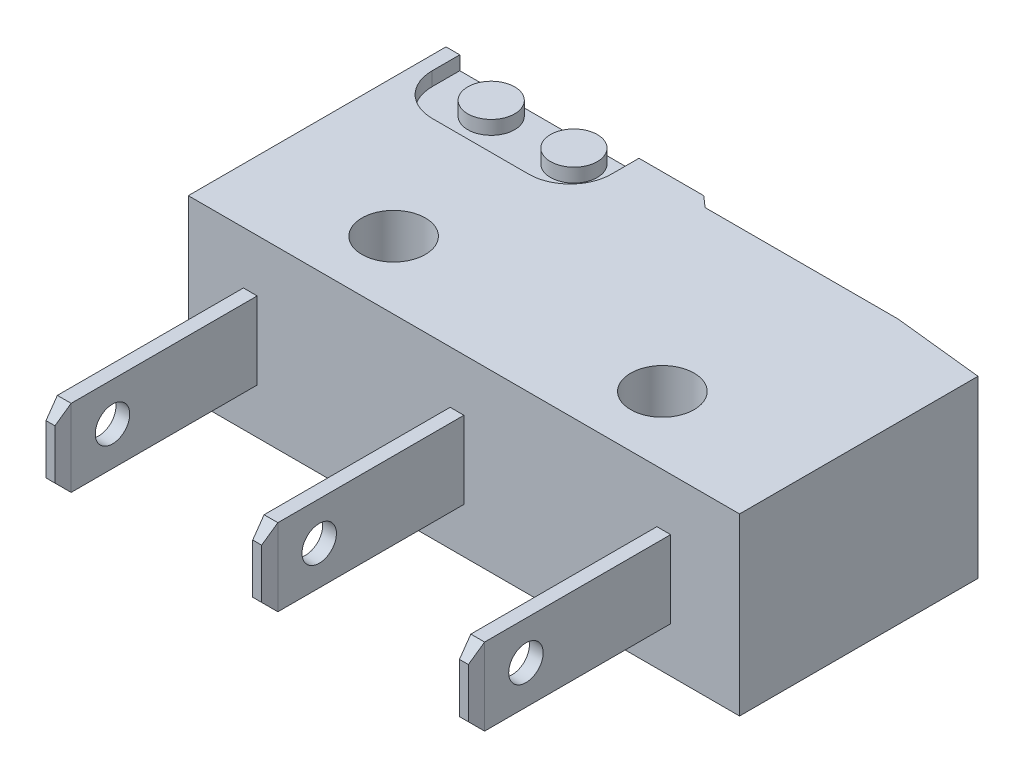
from build123d import *
from OCP.BRepFilletAPI import BRepFilletAPI_MakeChamfer

# Parameters (mm, degrees)
BOSS_EXTRUDE1_DEPTH = 6.35
SKETCH2_R           = 1.15
CUT_EXTRUDE1_DEPTH  = 6.35
SKETCH3_W           = 0.5
SKETCH3_H           = 2.8
BOSS_EXTRUDE2_DEPTH = 7.25
SKETCH4_R           = 0.625
CUT_EXTRUDE2_DEPTH  = 16.25
CHAMFER1_SIZE       = 0.5
CHAMFER2_SIZE       = 0.5
CHAMFER2_SIZE2      = 0.08816349
SKETCH5_W           = 6.5
SKETCH5_H           = 2.5
SKETCH5_R           = 0.85
CUT_EXTRUDE4_DEPTH  = 0.5
FILLET1_R           = 1.5


with BuildPart() as part:
    # Sketch1 → Boss-Extrude1 (new body)
    with BuildSketch(Plane(origin=(0, 0, 0), x_dir=(1, 0, 0), z_dir=(0, 1, 0))):
        Polygon((9.35, 9.35), (9.75, 9), (16.75, 9), (20, 8.65), (20, 0), (0, 0), (0, 9.35), align=None)
    extrude(amount=BOSS_EXTRUDE1_DEPTH)

    # Sketch2 → Cut-Extrude1 (cut)
    with BuildSketch(Plane(origin=(0, 6.35, 0), x_dir=(1, 0, 0), z_dir=(0, 1, 0))):
        with Locations(Location((14.75, 2.45, 0), (0, 0, 270))):
            Circle(SKETCH2_R)
        with Locations(Location((5, 2.45, 0), (0, 0, 270))):
            Circle(SKETCH2_R)
    extrude(amount=-CUT_EXTRUDE1_DEPTH, mode=Mode.SUBTRACT)

    # Sketch3 → Boss-Extrude2 (add)
    with BuildSketch(Plane.XY):
        with Locations((2.25, 3.05)):
            Rectangle(SKETCH3_W, SKETCH3_H)
        with Locations((9.75, 3.05)):
            Rectangle(SKETCH3_W, SKETCH3_H)
        with Locations((17.25, 3.05)):
            Rectangle(SKETCH3_W, SKETCH3_H)
    extrude(amount=BOSS_EXTRUDE2_DEPTH)

    # Sketch4 → Cut-Extrude2 (cut)
    with BuildSketch(Plane.ZY.offset(-2)):
        with Locations((5.25, 3.05)):
            Circle(SKETCH4_R)
    extrude(amount=-CUT_EXTRUDE2_DEPTH, mode=Mode.SUBTRACT)

    # Chamfer1
    chamfer1_edges = [part.edges().sort_by_distance(p)[0] for p in [
        (2.25, 4.45, 7.25),
        (2.25, 1.65, 7.25),
        (9.75, 1.65, 7.25),
        (9.75, 4.45, 7.25),
        (17.25, 1.65, 7.25),
        (17.25, 4.45, 7.25),
    ]]
    chamfer(chamfer1_edges, length=CHAMFER1_SIZE)

    # Chamfer2: one chamfer whose edges measure the first distance from different faces: ONE call of the kernel's chamfer builder (chamfer() names one face for all edges)
    chamfer2_edges_1 = [part.edges().sort_by_distance(p)[0] for p in [
        (2.5, 3.05, 7.25),
    ]]
    chamfer2_side_1 = [part.faces().sort_by_distance(p)[0] for p in [
        (2.5, 3.05, 3.473122701),
    ]]
    chamfer2_edges_2 = [part.edges().sort_by_distance(p)[0] for p in [
        (2, 3.05, 7.25),
    ]]
    chamfer2_side_2 = [part.faces().sort_by_distance(p)[0] for p in [
        (2, 3.05, 3.473122701),
    ]]
    chamfer2_edges_3 = [part.edges().sort_by_distance(p)[0] for p in [
        (9.5, 3.05, 7.25),
    ]]
    chamfer2_side_3 = [part.faces().sort_by_distance(p)[0] for p in [
        (9.5, 3.05, 3.473122701),
    ]]
    chamfer2_edges_4 = [part.edges().sort_by_distance(p)[0] for p in [
        (10, 3.05, 7.25),
    ]]
    chamfer2_side_4 = [part.faces().sort_by_distance(p)[0] for p in [
        (10, 3.05, 3.473122701),
    ]]
    chamfer2_edges_5 = [part.edges().sort_by_distance(p)[0] for p in [
        (17, 3.05, 7.25),
    ]]
    chamfer2_side_5 = [part.faces().sort_by_distance(p)[0] for p in [
        (17, 3.05, 3.473122701),
    ]]
    chamfer2_edges_6 = [part.edges().sort_by_distance(p)[0] for p in [
        (17.5, 3.05, 7.25),
    ]]
    chamfer2_side_6 = [part.faces().sort_by_distance(p)[0] for p in [
        (17.5, 3.05, 3.473122701),
    ]]
    chamfer2 = BRepFilletAPI_MakeChamfer(part.part.solid().wrapped)
    for e in chamfer2_edges_1:
        chamfer2.Add(CHAMFER2_SIZE, CHAMFER2_SIZE2, e.wrapped, chamfer2_side_1[0].wrapped)  # the first distance lies on this face
    for e in chamfer2_edges_2:
        chamfer2.Add(CHAMFER2_SIZE, CHAMFER2_SIZE2, e.wrapped, chamfer2_side_2[0].wrapped)  # the first distance lies on this face
    for e in chamfer2_edges_3:
        chamfer2.Add(CHAMFER2_SIZE, CHAMFER2_SIZE2, e.wrapped, chamfer2_side_3[0].wrapped)  # the first distance lies on this face
    for e in chamfer2_edges_4:
        chamfer2.Add(CHAMFER2_SIZE, CHAMFER2_SIZE2, e.wrapped, chamfer2_side_4[0].wrapped)  # the first distance lies on this face
    for e in chamfer2_edges_5:
        chamfer2.Add(CHAMFER2_SIZE, CHAMFER2_SIZE2, e.wrapped, chamfer2_side_5[0].wrapped)  # the first distance lies on this face
    for e in chamfer2_edges_6:
        chamfer2.Add(CHAMFER2_SIZE, CHAMFER2_SIZE2, e.wrapped, chamfer2_side_6[0].wrapped)  # the first distance lies on this face
    add(Compound.cast(chamfer2.Shape()), mode=Mode.REPLACE)

    # Sketch5 → Cut-Extrude4 (cut)
    with BuildSketch(Plane(origin=(0, 6.35, 0), x_dir=(1, 0, 0), z_dir=(0, 1, 0))):
        with Locations((3.75, 8.1)):
            Rectangle(SKETCH5_W, SKETCH5_H)
        with Locations(Location((2.5, 8.49, 0), (0, 0, 270))):
            Circle(SKETCH5_R, mode=Mode.SUBTRACT)
        with Locations(Location((5.5, 8.49, 0), (0, 0, 270))):
            Circle(SKETCH5_R, mode=Mode.SUBTRACT)
    cut_extrude4 = extrude(amount=-CUT_EXTRUDE4_DEPTH, mode=Mode.SUBTRACT)

    # Mirror1: Cut-Extrude4 across plane
    add(cut_extrude4.mirror(Plane(origin=(0, 3.175, 0), x_dir=(0, 0, 1), z_dir=(0, -1, 0))), mode=Mode.SUBTRACT)

    # Fillet1
    fillet1_edges = [part.edges().sort_by_distance(p)[0] for p in [
        (0.5, 6.1, -6.85),
        (7, 6.1, -6.85),
        (0.5, 0.25, -6.85),
        (7, 0.25, -6.85),
    ]]
    fillet(fillet1_edges, radius=FILLET1_R)


solid = part.part
